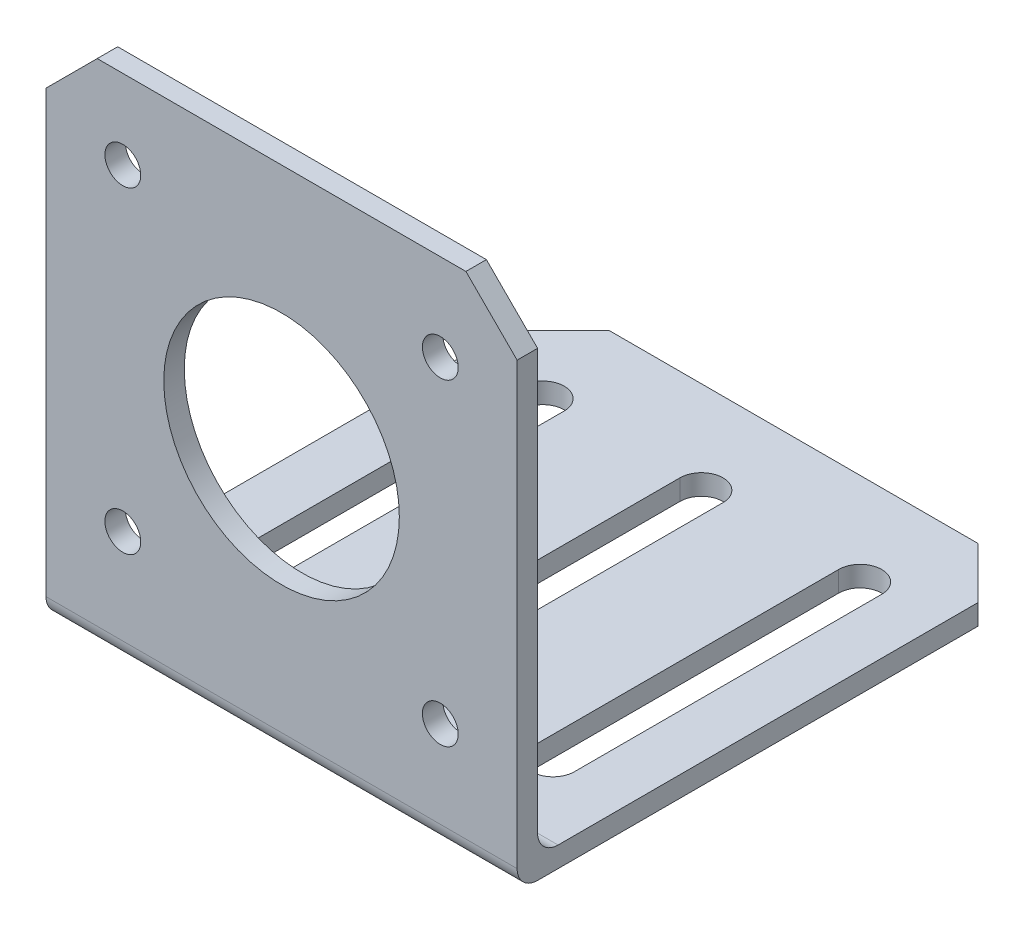
from build123d import *

# Parameters (mm, degrees)
SALIENTE_EXTRUIR1_DEPTH = 46
CROQUIS2_R              = 11.5
CROQUIS2_R_2            = 1.75
CORTAR_EXTRUIR1_DEPTH   = 85.356386836
CORTAR_EXTRUIR2_DEPTH   = 85.356386836
CHAFL_N1_SIZE           = 5
CORTE_EXTRUS_O1_DEPTH   = 85.356386836


with BuildPart() as part:
    # Croquis1 → Saliente-Extruir1 (new body)
    with BuildSketch(Plane(origin=(0, 0, 0), x_dir=(0, 0, -1), z_dir=(1, 0, 0))):
        with BuildLine():
            Line((2, 0), (50, 0))
            Line((50, 0), (50, 2))
            Line((50, 2), (4, 2))
            ThreePointArc((4, 2), (2.585786438, 2.585786438), (2, 4))
            Line((2, 4), (2, 50))
            Line((2, 50), (0, 50))
            Line((0, 50), (0, 2))
            ThreePointArc((0, 2), (0.585786438, 0.585786438), (2, 0))
        make_face()
    extrude(amount=SALIENTE_EXTRUIR1_DEPTH)

    # Croquis2 → Cortar-Extruir1 (cut, through all)
    with BuildSketch(Plane.XY):
        with Locations((23, 26)):
            Circle(CROQUIS2_R)
        with Locations((7.5, 42.25)):
            Circle(CROQUIS2_R_2)
        with Locations((38.5, 41.5)):
            Circle(CROQUIS2_R_2)
        with Locations((7.5, 11.25)):
            Circle(CROQUIS2_R_2)
        with Locations((38.5, 10.5)):
            Circle(CROQUIS2_R_2)
    extrude(amount=-CORTAR_EXTRUIR1_DEPTH, mode=Mode.SUBTRACT)

    # Croquis3 → Cortar-Extruir2 (cut, through all)
    with BuildSketch(Plane.XZ):
        with BuildLine():
            Line((5.4, -11), (5.4, -41))
            ThreePointArc((5.4, -41), (7.5, -43.1), (9.6, -41))
            Line((9.6, -41), (9.6, -11))
            ThreePointArc((9.6, -11), (7.5, -8.9), (5.4, -11))
        make_face()
        with BuildLine():
            Line((36.4, -11), (36.4, -41))
            ThreePointArc((36.4, -41), (38.5, -43.1), (40.6, -41))
            Line((40.6, -41), (40.6, -11))
            ThreePointArc((40.6, -11), (38.5, -8.9), (36.4, -11))
        make_face()
    extrude(amount=-CORTAR_EXTRUIR2_DEPTH, mode=Mode.SUBTRACT)

    # Chaflán1
    chafl_n1_edges = [part.edges().sort_by_distance(p)[0] for p in [
        (0, 1, -50),
        (46, 50, -1),
        (46, 1, -50),
        (0, 50, -1),
    ]]
    chamfer(chafl_n1_edges, length=CHAFL_N1_SIZE)

    # Esboço1 → Corte-extrusão1 (cut, through all)
    with BuildSketch(Plane.XZ):
        with BuildLine():
            Line((20.9, -41), (20.9, -11))
            ThreePointArc((20.9, -11), (23, -8.9), (25.1, -11))
            Line((25.1, -11), (25.1, -41))
            ThreePointArc((25.1, -41), (23, -43.1), (20.9, -41))
        make_face()
    extrude(amount=-CORTE_EXTRUS_O1_DEPTH, mode=Mode.SUBTRACT)


solid = part.part
